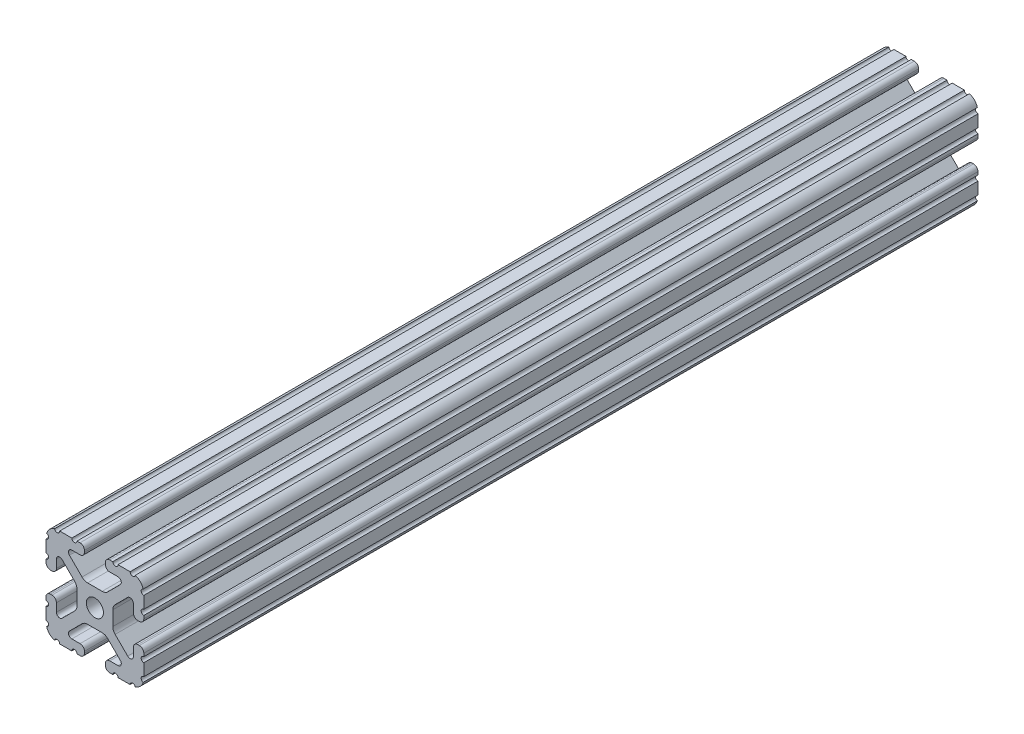
from build123d import *

# Parameters (mm, degrees)
BOSS_EXTRUDE1_DEPTH     = 162.515
CUT_EXTRUDE1_DEPTH      = 165.732905714
CUT_EXTRUDE1_DEPTH_BACK = 165.732905714
SKETCH5_R               = 1.016


with BuildPart() as part:
    # Sketch4 → Boss-Extrude1 (new, symmetric)
    with BuildSketch(Plane.XY):
        with BuildLine():
            Line((5.7912, -19.05), (14.3002, -19.05))
            ThreePointArc((14.3002, -19.05), (17.658815789, -17.658815789), (19.05, -14.3002))
            Line((19.05, -14.3002), (19.05, -5.7912))
            ThreePointArc((19.05, -5.7912), (18.544114832, -4.569885168), (17.3228, -4.064))
            Line((17.3228, -4.064), (16.7132, -4.064))
            ThreePointArc((16.7132, -4.064), (15.491885168, -4.569885168), (14.986, -5.7912))
            Line((14.986, -5.7912), (14.986, -8.996305235))
            ThreePointArc((14.986, -8.996305235), (14.189232738, -10.188751711), (12.782646215, -9.908964256))
            Line((12.782646215, -9.908964256), (7.888897763, -5.015215804))
            ThreePointArc((7.888897763, -5.015215804), (7.219915375, -4.014012907), (6.985, -2.833013566))
            Line((6.985, -2.833013566), (6.985, 0))
            Line((6.985, 0), (3.3274, 0))
            ThreePointArc((3.3274, 0), (2.352827104, -2.352827104), (0, -3.3274))
            Line((0, -3.3274), (0, -6.985))
            Line((0, -6.985), (2.833013566, -6.985))
            ThreePointArc((2.833013566, -6.985), (4.014012907, -7.219915375), (5.015215804, -7.888897763))
            Line((5.015215804, -7.888897763), (9.908964256, -12.782646215))
            ThreePointArc((9.908964256, -12.782646215), (10.188751711, -14.189232738), (8.996305235, -14.986))
            Line((8.996305235, -14.986), (5.7912, -14.986))
            ThreePointArc((5.7912, -14.986), (4.569885168, -15.491885168), (4.064, -16.7132))
            Line((4.064, -16.7132), (4.064, -17.3228))
            ThreePointArc((4.064, -17.3228), (4.569885168, -18.544114832), (5.7912, -19.05))
        make_face()
    extrude(amount=BOSS_EXTRUDE1_DEPTH, both=True)

    # Sketch5 → Cut-Extrude1 (cut, two sides: drawn at the far end of the back side and taken through both)
    with BuildSketch(Plane.XY.offset(-CUT_EXTRUDE1_DEPTH_BACK)):
        with Locations((14.739477062, -19.05)):
            Circle(SKETCH5_R)
        with Locations((7.980305235, -19.05)):
            Circle(SKETCH5_R)
        with Locations((19.05, -14.739477062)):
            Circle(SKETCH5_R)
        with Locations((19.05, -7.980305235)):
            Circle(SKETCH5_R)
    extrude(amount=CUT_EXTRUDE1_DEPTH + CUT_EXTRUDE1_DEPTH_BACK, mode=Mode.SUBTRACT)

    # Mirror1: part across plane


with BuildPart() as part_1:
    add(part.part)
    add(part.part.mirror(Plane(origin=(0, 0, 0), x_dir=(0, 0, 1), z_dir=(1, 0, 0))))

    # Mirror2: part across plane


with BuildPart() as part_2:
    add(part_1.part)
    add(part_1.part.mirror(Plane.ZX))


solid = part_2.part
